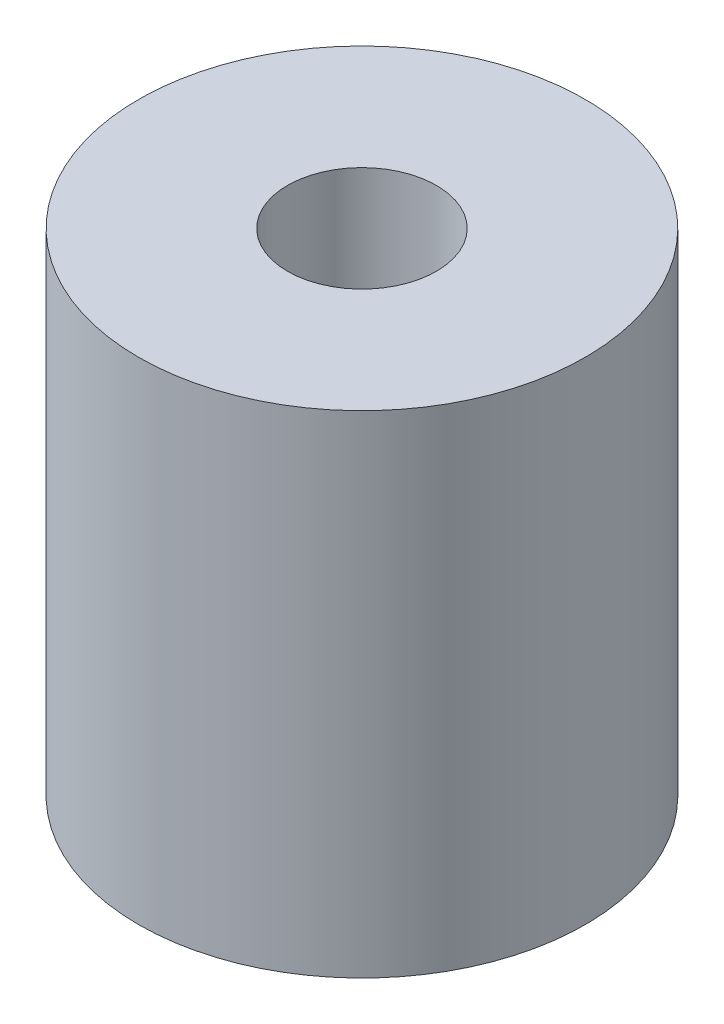
from build123d import *

# Parameters (mm, degrees)
SKETCH1_R           = 3
SKETCH1_R_2         = 1
BOSS_EXTRUDE1_DEPTH = 6.6


with BuildPart() as part:
    # Sketch1 → Boss-Extrude1 (new body)
    with BuildSketch(Plane(origin=(0, 0, 0), x_dir=(1, 0, 0), z_dir=(0, 1, 0))):
        with Locations(Location((0, 0, 0), (0, 0, 270))):
            Circle(SKETCH1_R)
        with Locations(Location((0, 0, 0), (0, 0, 270))):
            Circle(SKETCH1_R_2, mode=Mode.SUBTRACT)
    extrude(amount=BOSS_EXTRUDE1_DEPTH)


solid = part.part
